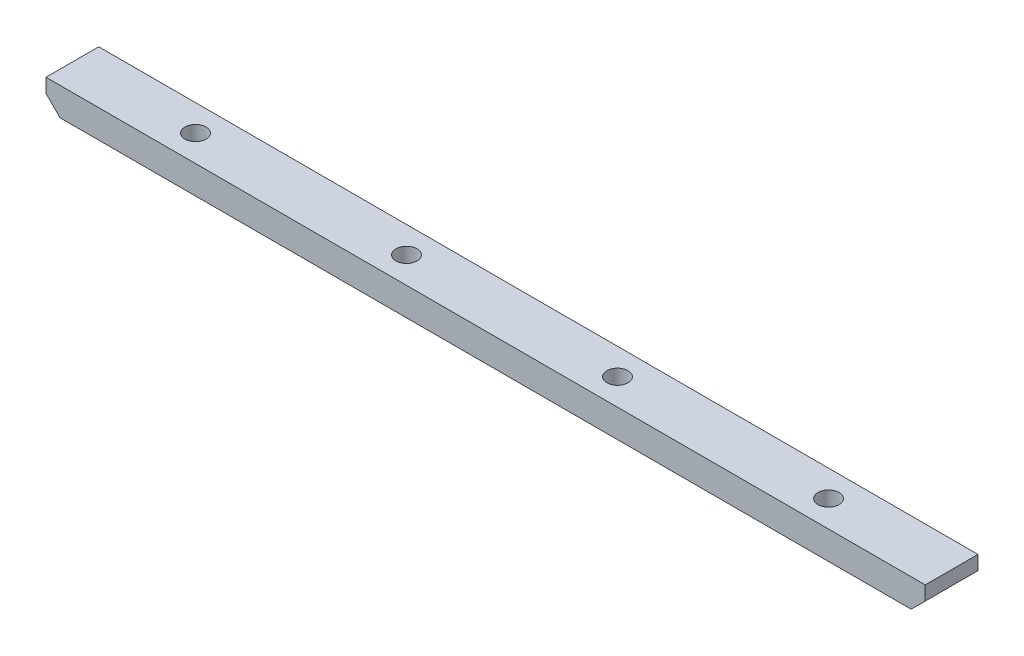
from build123d import *

# Parameters (mm, degrees)
SKETCH_2_W        = 250
SKETCH_2_H        = 8
EXTRUDE_262_DEPTH = 15
HOLE_WIZARD_6_D   = 6
CHAMFER_1283_SIZE = 4


with BuildPart() as part:
    # Эскиз2 → Extrude 262 (new body)
    with BuildSketch(Plane.XY):
        Rectangle(SKETCH_2_W, SKETCH_2_H)
    extrude(amount=-EXTRUDE_262_DEPTH)

    # Отверстия-6мм (through all)
    with Locations(Plane(origin=(0, 4, 0), x_dir=(-1, 0, 0), z_dir=(0, 1, 0))):
        with Locations((90, -7.5), (-90, -7.5), (30, -7.5), (-30, -7.5)):
            Hole(HOLE_WIZARD_6_D / 2)

    # Chamfer 1283
    chamfer_1283_edges = [part.edges().sort_by_distance(p)[0] for p in [
        (125, -4, -7.5),
        (-125, -4, -7.5),
    ]]
    chamfer(chamfer_1283_edges, length=CHAMFER_1283_SIZE)


solid = part.part
